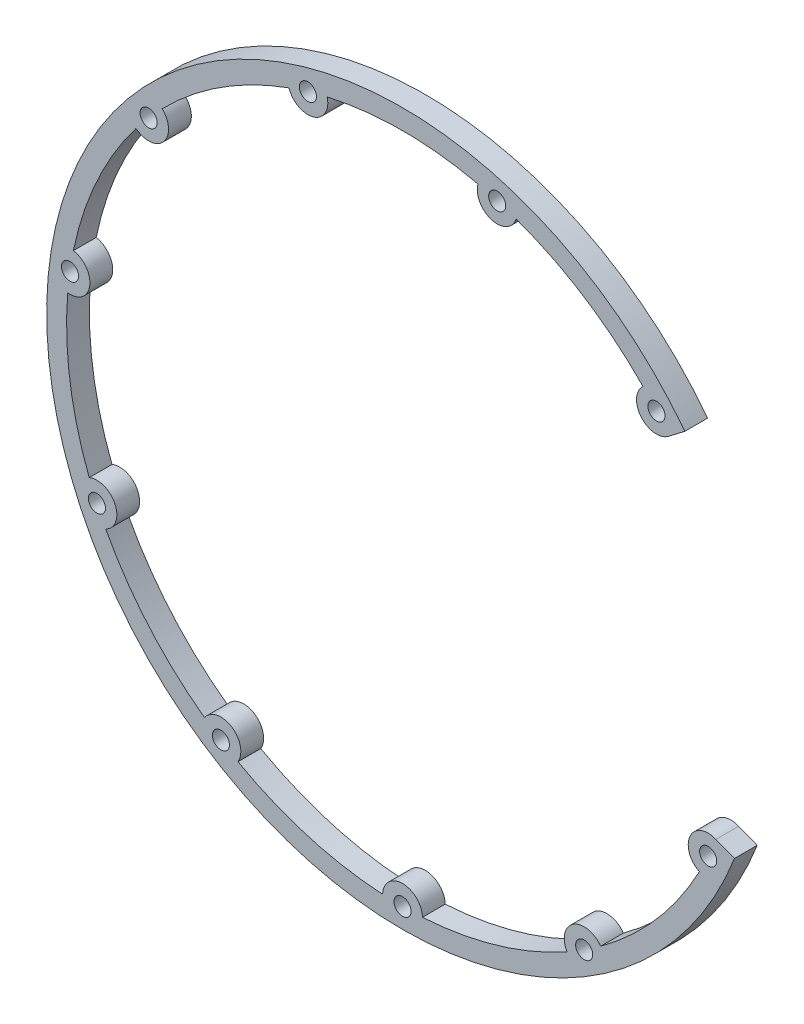
from build123d import *

# Parameters (mm, degrees)
SKETCH_1_R      = 1.5
EXTRUDE_1_DEPTH = 4


with BuildPart() as part:
    # 草图1 → 凸台-拉伸1 (new body)
    with BuildSketch(Plane.XY):
        with BuildLine():
            Line((46.801771952, 35.924840183), (49.578148254, 38.05597477))
            ThreePointArc((49.578148254, 38.05597477), (-61.863840118, -8.894677392), (58.29149197, -22.546661925))
            Line((58.29149197, -22.546661925), (55.027168419, -21.284048857))
            ThreePointArc((55.027168419, -21.284048857), (50.484575742, -23.055533222), (52.120542762, -27.648671255))
            ThreePointArc((52.120542762, -27.648671255), (44.589224887, -38.636783303), (34.784774262, -47.65521461))
            ThreePointArc((34.784774262, -47.65521461), (30.005565369, -46.689571072), (28.898590503, -51.438035217))
            ThreePointArc((28.898590503, -51.438035217), (16.622220854, -56.610085443), (3.498460053, -58.896186441))
            ThreePointArc((3.498460053, -58.896186441), (0, -55.5), (-3.498460053, -58.896186441))
            ThreePointArc((-3.498460053, -58.896186441), (-16.622220854, -56.610085443), (-28.898590503, -51.438035217))
            ThreePointArc((-28.898590503, -51.438035217), (-30.005565369, -46.689571072), (-34.784774262, -47.65521461))
            ThreePointArc((-34.784774262, -47.65521461), (-44.589224887, -38.636783303), (-52.120542762, -27.648671255))
            ThreePointArc((-52.120542762, -27.648671255), (-50.484575742, -23.055533222), (-55.027168419, -21.284048857))
            ThreePointArc((-55.027168419, -21.284048857), (-58.399465071, -8.396575458), (-58.794590961, 4.918950474))
            ThreePointArc((-58.794590961, 4.918950474), (-54.935090024, 7.898473524), (-57.798825407, 11.844652023))
            ThreePointArc((-57.798825407, 11.844652023), (-53.668287726, 24.509485767), (-46.801771952, 35.924840183))
            ThreePointArc((-46.801771952, 35.924840183), (-41.944101377, 36.344770734), (-42.219763715, 41.212759575))
            ThreePointArc((-42.219763715, 41.212759575), (-31.89780823, 49.633958437), (-19.949721034, 55.524846967))
            ThreePointArc((-19.949721034, 55.524846967), (-15.636156905, 53.251860036), (-13.236225354, 57.496107158))
            ThreePointArc((-13.236225354, 57.496107158), (0, 59), (13.236225354, 57.496107158))
            ThreePointArc((13.236225354, 57.496107158), (15.636156905, 53.251860036), (19.949721034, 55.524846967))
            ThreePointArc((19.949721034, 55.524846967), (31.89780823, 49.633958437), (42.219763715, 41.212759575))
            ThreePointArc((42.219763715, 41.212759575), (41.944101377, 36.344770734), (46.801771952, 35.924840183))
        make_face()
        with Locations((0, -59)):
            Circle(SKETCH_1_R, mode=Mode.SUBTRACT)
        with Locations((-31.89780823, -49.633958437)):
            Circle(SKETCH_1_R, mode=Mode.SUBTRACT)
        with Locations((-53.668287726, -24.509485767)):
            Circle(SKETCH_1_R, mode=Mode.SUBTRACT)
        with Locations((-58.399465071, 8.396575458)):
            Circle(SKETCH_1_R, mode=Mode.SUBTRACT)
        with Locations((-44.589224887, 38.636783303)):
            Circle(SKETCH_1_R, mode=Mode.SUBTRACT)
        with Locations((-16.622220854, 56.610085443)):
            Circle(SKETCH_1_R, mode=Mode.SUBTRACT)
        with Locations((16.622220854, 56.610085443)):
            Circle(SKETCH_1_R, mode=Mode.SUBTRACT)
        with Locations((44.589224887, 38.636783303)):
            Circle(SKETCH_1_R, mode=Mode.SUBTRACT)
        with Locations((53.668287726, -24.509485767)):
            Circle(SKETCH_1_R, mode=Mode.SUBTRACT)
        with Locations((31.89780823, -49.633958437)):
            Circle(SKETCH_1_R, mode=Mode.SUBTRACT)
    extrude(amount=EXTRUDE_1_DEPTH)


solid = part.part
